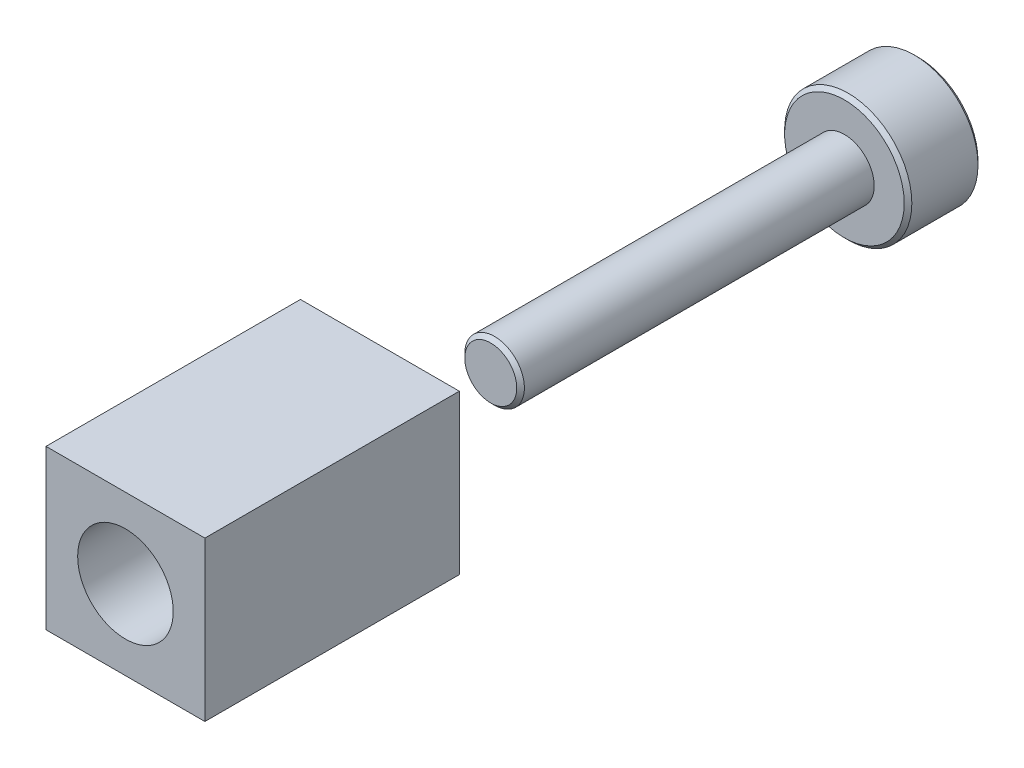
from build123d import *

# Parameters (mm, degrees)
SKETCH1_R           = 12.7
BOSS_EXTRUDE1_DEPTH = 14.732
SKETCH2_R           = 5.953696188
BOSS_EXTRUDE2_DEPTH = 70.612
SKETCH3_W           = 31.722698392
SKETCH3_H           = 31.722698392
BOSS_EXTRUDE3_DEPTH = 50.8
SKETCH4_R           = 9.541732236
CUT_EXTRUDE1_DEPTH  = 110.798996017
CHAMFER1_SIZE       = 0.762


with BuildPart() as part:
    # Sketch1 → Boss-Extrude1 (new body)
    with BuildSketch(Plane.XY):
        Circle(SKETCH1_R)
    extrude(amount=BOSS_EXTRUDE1_DEPTH)

    # Sketch2 → Boss-Extrude2 (add)
    with BuildSketch(Plane.XY.offset(14.732)):
        Circle(SKETCH2_R)
    extrude(amount=BOSS_EXTRUDE2_DEPTH)

    # Chamfer1
    chamfer1_edges = [part.edges().sort_by_distance(p)[0] for p in [
        (-12.7, 0, 0),
        (-12.7, 0, 14.732),
        (-5.953696188, 0, 85.344),
    ]]
    chamfer(chamfer1_edges, length=CHAMFER1_SIZE)


with BuildPart() as body_2:
    # Sketch3 → Boss-Extrude3 (new body)
    with BuildSketch(Plane.XY.offset(107.483276511)):
        Rectangle(SKETCH3_W, SKETCH3_H)
    extrude(amount=BOSS_EXTRUDE3_DEPTH)

    # Sketch4 → Cut-Extrude1 (cut, through all)
    with BuildSketch(Plane(origin=(0, 0, 107.483276511), x_dir=(-1, 0, 0), z_dir=(0, 0, -1))):
        Circle(SKETCH4_R)
    extrude(amount=-CUT_EXTRUDE1_DEPTH, mode=Mode.SUBTRACT)


solid = Compound([part.part, body_2.part])
